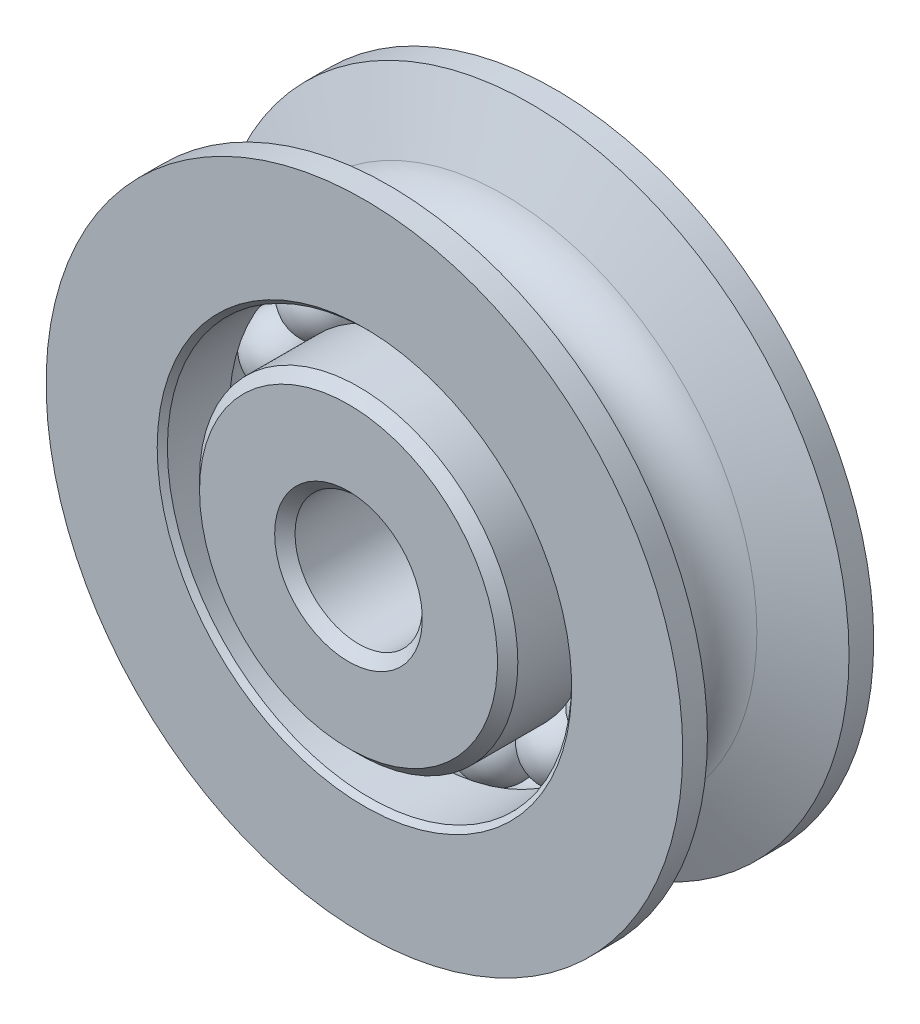
from build123d import *

# Parameters (mm, degrees)
CIRPATTERN1_COUNT = 15
CHAMFER1_SIZE     = 0.508
CHAMFER2_SIZE     = 0.254


with BuildPart() as part:
    # Sketch1 → Revolve1 (revolve)
    with BuildSketch(Plane(origin=(0, 0, 0), x_dir=(0, 0, -1), z_dir=(1, 0, 0)), mode=Mode.PRIVATE) as revolve1_sk:
        with BuildLine():
            Line((3.5306, 15.875), (4.7625, 15.875))
            Line((4.7625, 15.875), (4.7625, 10.080625))
            Line((4.7625, 10.080625), (1.42875, 10.080625))
            ThreePointArc((1.42875, 10.080625), (0, 10.795), (-1.42875, 10.080625))
            Line((-1.42875, 10.080625), (-4.7625, 10.080625))
            Line((-4.7625, 10.080625), (-4.7625, 15.875))
            Line((-4.7625, 15.875), (-3.5306, 15.875))
            Line((-3.5306, 15.875), (-2.207797586, 12.601572113))
            ThreePointArc((-2.207797586, 12.601572113), (0, 11.1125), (2.207797586, 12.601572113))
            Line((2.207797586, 12.601572113), (3.5306, 15.875))
        make_face()
        with BuildLine():
            Line((5.55625, 3.175), (-5.55625, 3.175))
            Line((-5.55625, 3.175), (-5.55625, 7.9375))
            Line((-5.55625, 7.9375), (-1.42875, 7.9375))
            ThreePointArc((-1.42875, 7.9375), (0, 7.223125), (1.42875, 7.9375))
            Line((1.42875, 7.9375), (5.55625, 7.9375))
            Line((5.55625, 7.9375), (5.55625, 3.175))
        make_face()
    revolve(revolve1_sk.sketch.rotate(Axis((0, 0, 5.55625), (0, 0, -1)), 90), axis=Axis((0, 0, 5.55625), (0, 0, -1)))

    # Chamfer1
    chamfer1_edges = [part.edges().sort_by_distance(p)[0] for p in [
        (-7.9375, 0, 5.55625),
        (-7.9375, 0, -5.55625),
        (-3.175, 0, -5.55625),
        (-3.175, 0, 5.55625),
    ]]
    chamfer(chamfer1_edges, length=CHAMFER1_SIZE)

    # Chamfer2
    chamfer2_edges = [part.edges().sort_by_distance(p)[0] for p in [
        (-10.080625, 0, -4.7625),
        (-10.080625, 0, 4.7625),
    ]]
    chamfer(chamfer2_edges, length=CHAMFER2_SIZE)


with BuildPart() as body_2:
    # Sketch2 → Revolve2 (revolve)
    with BuildSketch(Plane(origin=(0, 0, 0), x_dir=(0, 0, -1), z_dir=(1, 0, 0))):
        with BuildLine():
            Line((0, 10.795), (0, 7.223125))
            ThreePointArc((0, 7.223125), (1.7859375, 9.0090625), (0, 10.795))
        make_face()
    revolve(axis=Axis((0, 10.795, 0), (0, -1, 0)))


with BuildPart() as cirpattern1_1:
    # CirPattern1: pattern copy
    add(body_2.part.rotate(Axis((0, 0, 0), (0, 0, 1)), 1 * 360 / CIRPATTERN1_COUNT))


with BuildPart() as cirpattern1_2:
    # CirPattern1: pattern copy
    add(body_2.part.rotate(Axis((0, 0, 0), (0, 0, 1)), 2 * 360 / CIRPATTERN1_COUNT))


with BuildPart() as cirpattern1_3:
    # CirPattern1: pattern copy
    add(body_2.part.rotate(Axis((0, 0, 0), (0, 0, 1)), 3 * 360 / CIRPATTERN1_COUNT))


with BuildPart() as cirpattern1_4:
    # CirPattern1: pattern copy
    add(body_2.part.rotate(Axis((0, 0, 0), (0, 0, 1)), 4 * 360 / CIRPATTERN1_COUNT))


with BuildPart() as cirpattern1_5:
    # CirPattern1: pattern copy
    add(body_2.part.rotate(Axis((0, 0, 0), (0, 0, 1)), 5 * 360 / CIRPATTERN1_COUNT))


with BuildPart() as cirpattern1_6:
    # CirPattern1: pattern copy
    add(body_2.part.rotate(Axis((0, 0, 0), (0, 0, 1)), 6 * 360 / CIRPATTERN1_COUNT))


with BuildPart() as cirpattern1_7:
    # CirPattern1: pattern copy
    add(body_2.part.rotate(Axis((0, 0, 0), (0, 0, 1)), 7 * 360 / CIRPATTERN1_COUNT))


with BuildPart() as cirpattern1_8:
    # CirPattern1: pattern copy
    add(body_2.part.rotate(Axis((0, 0, 0), (0, 0, 1)), 8 * 360 / CIRPATTERN1_COUNT))


with BuildPart() as cirpattern1_9:
    # CirPattern1: pattern copy
    add(body_2.part.rotate(Axis((0, 0, 0), (0, 0, 1)), 9 * 360 / CIRPATTERN1_COUNT))


with BuildPart() as cirpattern1_10:
    # CirPattern1: pattern copy
    add(body_2.part.rotate(Axis((0, 0, 0), (0, 0, 1)), 10 * 360 / CIRPATTERN1_COUNT))


with BuildPart() as cirpattern1_11:
    # CirPattern1: pattern copy
    add(body_2.part.rotate(Axis((0, 0, 0), (0, 0, 1)), 11 * 360 / CIRPATTERN1_COUNT))


with BuildPart() as cirpattern1_12:
    # CirPattern1: pattern copy
    add(body_2.part.rotate(Axis((0, 0, 0), (0, 0, 1)), 12 * 360 / CIRPATTERN1_COUNT))


with BuildPart() as cirpattern1_13:
    # CirPattern1: pattern copy
    add(body_2.part.rotate(Axis((0, 0, 0), (0, 0, 1)), 13 * 360 / CIRPATTERN1_COUNT))


with BuildPart() as cirpattern1_14:
    # CirPattern1: pattern copy
    add(body_2.part.rotate(Axis((0, 0, 0), (0, 0, 1)), 14 * 360 / CIRPATTERN1_COUNT))


solid = Compound([part.part, body_2.part, cirpattern1_1.part, cirpattern1_2.part, cirpattern1_3.part, cirpattern1_4.part, cirpattern1_5.part, cirpattern1_6.part, cirpattern1_7.part, cirpattern1_8.part, cirpattern1_9.part, cirpattern1_10.part, cirpattern1_11.part, cirpattern1_12.part, cirpattern1_13.part, cirpattern1_14.part])
